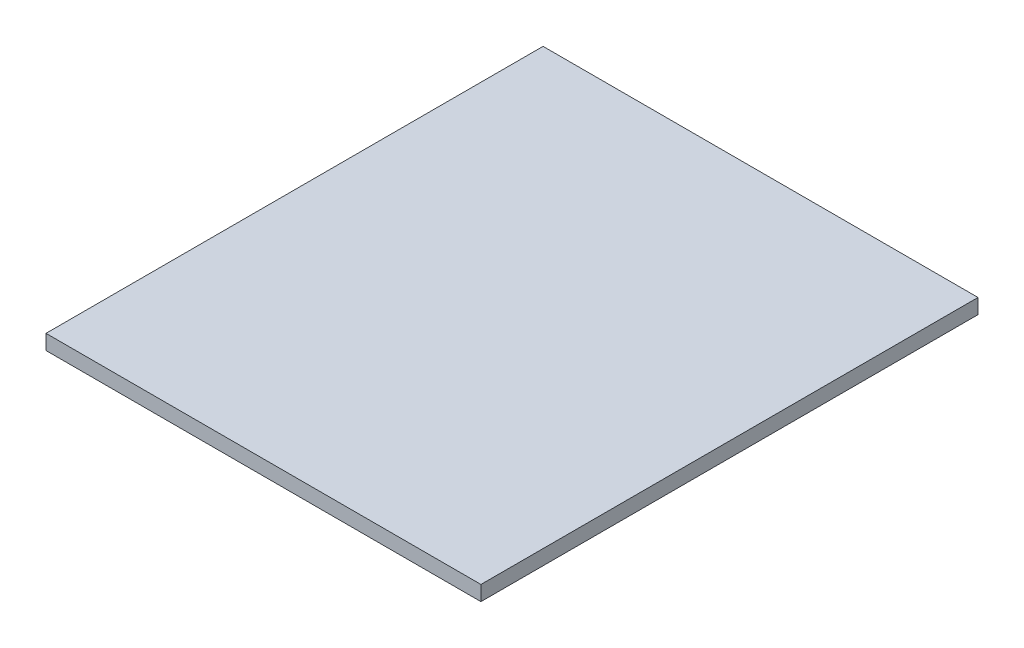
from build123d import *

# Parameters (mm, degrees)
SKETCH_1_W      = 350
SKETCH_1_H      = 400
EXTRUDE_1_DEPTH = 12


with BuildPart() as part:
    # 草图1 → 凸台-拉伸1 (new body)
    with BuildSketch(Plane(origin=(0, 0, 0), x_dir=(1, 0, 0), z_dir=(0, 1, 0))):
        with Locations((175, 200)):
            Rectangle(SKETCH_1_W, SKETCH_1_H)
    extrude(amount=EXTRUDE_1_DEPTH)


solid = part.part
